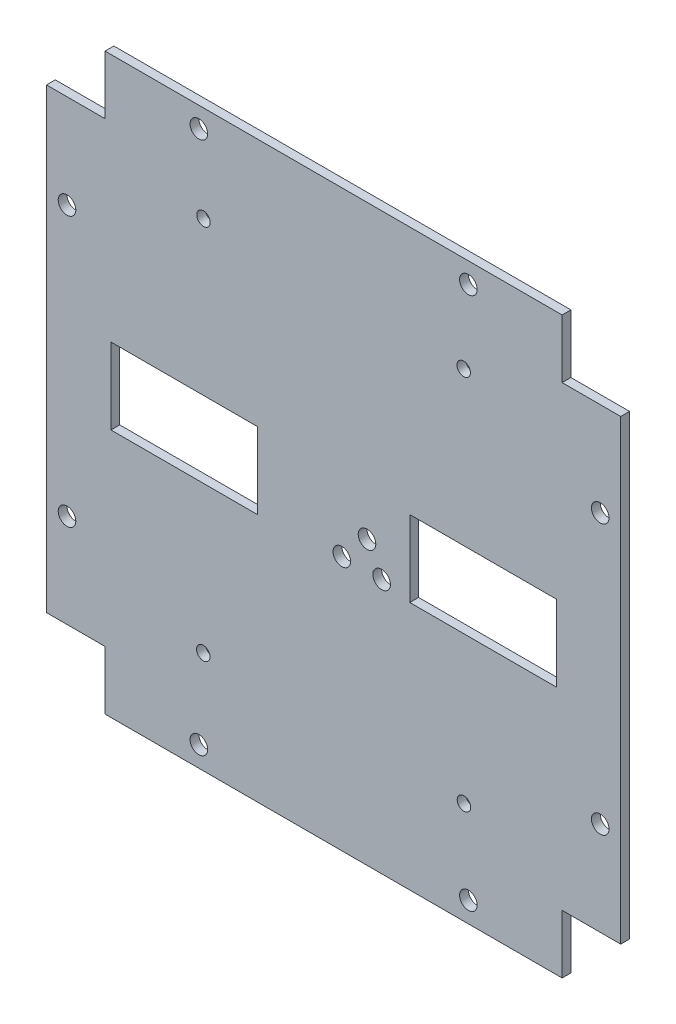
from build123d import *

# Parameters (mm, degrees)
SKETCH1_W                      = 98
SKETCH1_H                      = 98
BOSS_EXTRUDE1_DEPTH            = 1.5
SKETCH2_W                      = 10
SKETCH2_H                      = 10
CUT_EXTRUDE1_DEPTH             = 10
F_3_0_3_DIAMETER_HOLE1_D       = 3
SKETCH5_W                      = 25
SKETCH5_H                      = 13
CUT_EXTRUDE2_DEPTH             = 10
F_2_3_2_3_DIAMETER_HOLE1_D     = 2.3
F_2_3_2_3_DIAMETER_HOLE1_DEPTH = 30
SKETCH8_R                      = 1.5
CUT_EXTRUDE3_DEPTH             = 10
F_3_0_3_DIAMETER_HOLE2_D       = 3
F_3_0_3_DIAMETER_HOLE2_DEPTH   = 6.5


with BuildPart() as part:
    # Sketch1 → Boss-Extrude1 (new body)
    with BuildSketch(Plane.XY):
        Rectangle(SKETCH1_W, SKETCH1_H)
    extrude(amount=BOSS_EXTRUDE1_DEPTH)

    # Sketch2 → Cut-Extrude1 (cut)
    with BuildSketch(Plane.XY.offset(1.5)):
        with Locations((-44, 44)):
            Rectangle(SKETCH2_W, SKETCH2_H)
        with Locations((44, 44)):
            Rectangle(SKETCH2_W, SKETCH2_H)
        with Locations((44, -44)):
            Rectangle(SKETCH2_W, SKETCH2_H)
        with Locations((-44, -44)):
            Rectangle(SKETCH2_W, SKETCH2_H)
    extrude(amount=-CUT_EXTRUDE1_DEPTH, mode=Mode.SUBTRACT)

    # Ø3.0 (3) Diameter Hole1 (through all)
    with Locations(Plane(origin=(0, 0, 0), x_dir=(-1, 0, 0), z_dir=(0, 0, -1))):
        with Locations((-23, 45.5), (23, 45.5), (45.5, 23), (45.5, -23), (23, -45.5), (-23, -45.5), (-45.5, -23), (-45.5, 23)):
            Hole(F_3_0_3_DIAMETER_HOLE1_D / 2)

    # Sketch5 → Cut-Extrude2 (cut)
    with BuildSketch(Plane.XY.offset(1.5)):
        with Locations((-25.5, 0)):
            Rectangle(SKETCH5_W, SKETCH5_H)
        with Locations((25.5, 0)):
            Rectangle(SKETCH5_W, SKETCH5_H)
    extrude(amount=-CUT_EXTRUDE2_DEPTH, mode=Mode.SUBTRACT)

    # Ø2.3 (2.3) Diameter Hole1
    with Locations(Plane.XY.offset(1.5)):
        with Locations((-22.24500144, -31.590736692), (-22.203117232, 32.633806534), (22.203117232, 32.633806534), (22.24500144, -31.590736692)):
            Hole(F_2_3_2_3_DIAMETER_HOLE1_D / 2, depth=F_2_3_2_3_DIAMETER_HOLE1_DEPTH)

    # Sketch8 → Cut-Extrude3 (cut)
    with BuildSketch(Plane(origin=(0, 0, 0), x_dir=(-1, 0, 0), z_dir=(0, 0, -1))):
        with Locations((-5.7, -0.8)):
            Circle(SKETCH8_R)
    extrude(amount=-CUT_EXTRUDE3_DEPTH, mode=Mode.SUBTRACT)

    # Ø3.0 (3) Diameter Hole2
    with Locations(Plane(origin=(0, 0, 0), x_dir=(-1, 0, 0), z_dir=(0, 0, -1))):
        with Locations((-1.4, -5.5), (-8.2, -5.5)):
            Hole(F_3_0_3_DIAMETER_HOLE2_D / 2, depth=F_3_0_3_DIAMETER_HOLE2_DEPTH)


solid = part.part
